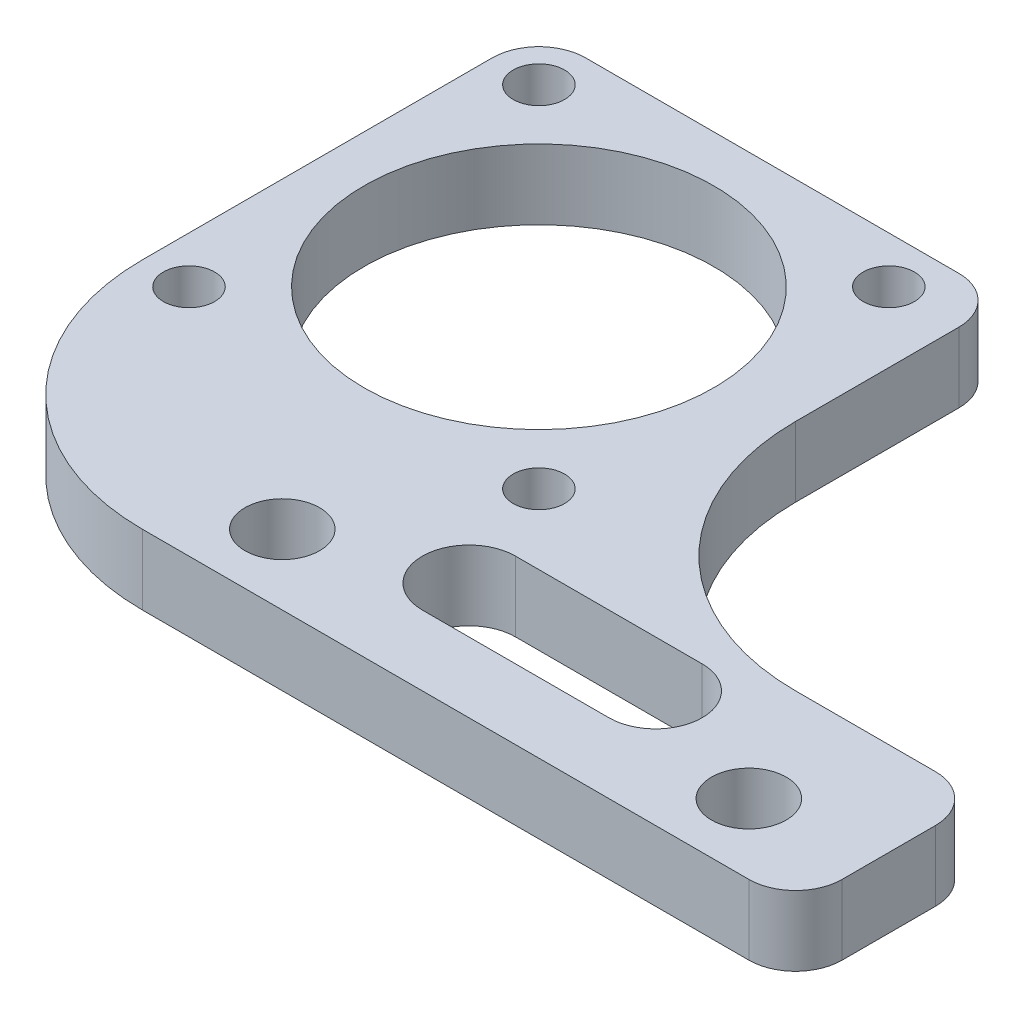
from build123d import *

# Parameters (mm, degrees)
SKETCH_1_W          = 38
SKETCH_1_H          = 27
SKETCH_1_R          = 1.1
SKETCH_1_R_2        = 1.6
EXTRUDE_1_DEPTH     = 3
SKETCH_2_R          = 7.5
SKETCH_2_W          = 18
SKETCH_2_H          = 19
CUT_EXTRUDE_1_DEPTH = 21.5
FILLET_1_R          = 10
CUT_EXTRUDE_2_DEPTH = 21.5
FILLET_2_R          = 2


with BuildPart() as part:
    # 草图1 → 凸台-拉伸1 (new body)
    with BuildSketch(Plane(origin=(0, 0, 0), x_dir=(1, 0, 0), z_dir=(0, 1, 0))):
        with Locations((9.5, -4)):
            Rectangle(SKETCH_1_W, SKETCH_1_H)
        with Locations(Location((7.5, -7.5, 0), (0, 0, 270))):
            Circle(SKETCH_1_R, mode=Mode.SUBTRACT)
        with Locations(Location((7.5, 7.5, 0), (0, 0, 270))):
            Circle(SKETCH_1_R, mode=Mode.SUBTRACT)
        with Locations(Location((-7.5, 7.5, 0), (0, 0, 270))):
            Circle(SKETCH_1_R, mode=Mode.SUBTRACT)
        with Locations(Location((-7.5, -7.5, 0), (0, 0, 270))):
            Circle(SKETCH_1_R, mode=Mode.SUBTRACT)
        with Locations(Location((3.5, -14.5, 0), (0, 0, 270))):
            Circle(SKETCH_1_R_2, mode=Mode.SUBTRACT)
        with Locations(Location((23.5, -14.5, 0), (0, 0, 270))):
            Circle(SKETCH_1_R_2, mode=Mode.SUBTRACT)
    extrude(amount=EXTRUDE_1_DEPTH)

    # 草图2 → 切除-拉伸1 (cut)
    with BuildSketch(Plane(origin=(0, 3, 0), x_dir=(1, 0, 0), z_dir=(0, 1, 0))):
        with Locations(Location((0, 0, 0), (0, 0, 270))):
            Circle(SKETCH_2_R)
        with Locations((19.5, 0)):
            Rectangle(SKETCH_2_W, SKETCH_2_H)
    extrude(amount=-CUT_EXTRUDE_1_DEPTH, mode=Mode.SUBTRACT)

    # 圆角1
    fillet_1_edges = [part.edges().sort_by_distance(p)[0] for p in [
        (10.5, 1.5, 9.5),
        (-9.5, 1.5, 17.5),
    ]]
    fillet(fillet_1_edges, radius=FILLET_1_R)

    # 草图3 → 切除-拉伸2 (cut)
    with BuildSketch(Plane(origin=(0, 3, 0), x_dir=(1, 0, 0), z_dir=(0, 1, 0))):
        with BuildLine():
            Line((9.5, -10.5), (17.5, -10.5))
            ThreePointArc((17.5, -10.5), (19.5, -12.5), (17.5, -14.5))
            Line((17.5, -14.5), (9.5, -14.5))
            ThreePointArc((9.5, -14.5), (7.5, -12.5), (9.5, -10.5))
        make_face()
    extrude(amount=-CUT_EXTRUDE_2_DEPTH, mode=Mode.SUBTRACT)

    # 圆角2
    fillet_2_edges = [part.edges().sort_by_distance(p)[0] for p in [
        (10.5, 1.5, -9.5),
        (28.5, 1.5, 9.5),
        (-9.5, 1.5, -9.5),
        (28.5, 1.5, 17.5),
    ]]
    fillet(fillet_2_edges, radius=FILLET_2_R)


solid = part.part
